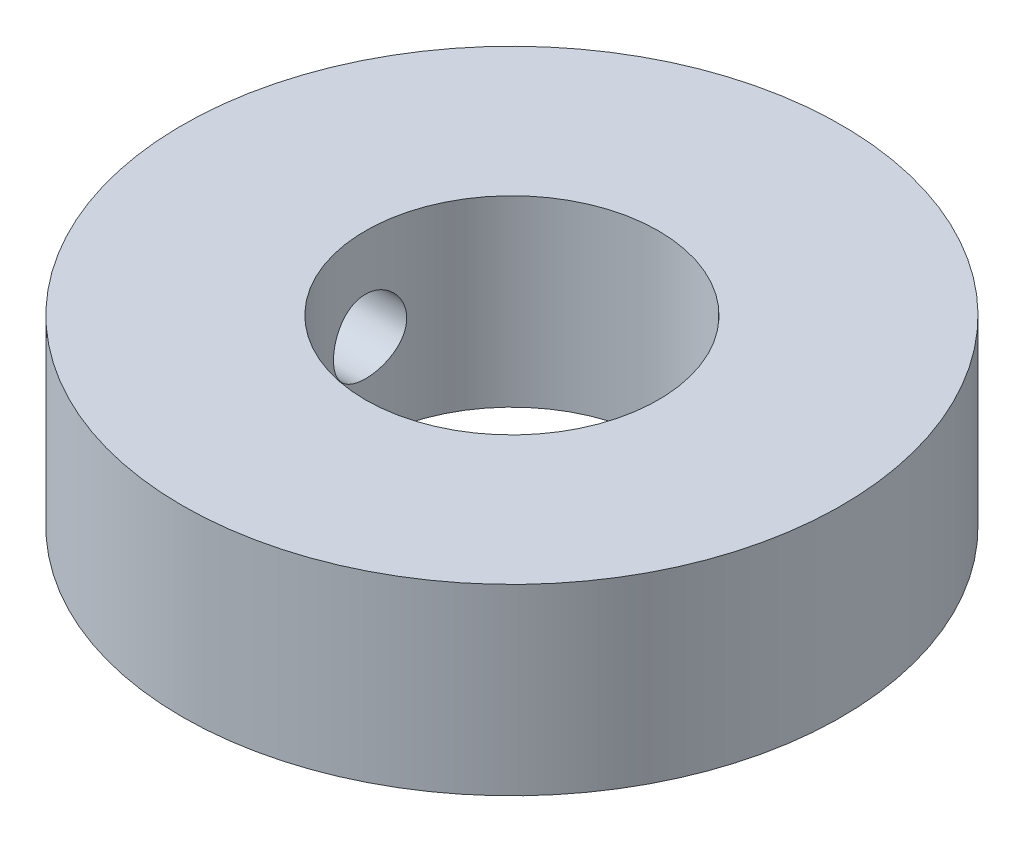
from build123d import *

# Parameters (mm, degrees)
SKETCH_1_R          = 9
SKETCH_1_R_2        = 4
EXTRUDE_1_DEPTH     = 5
SKETCH_2_R          = 1
CUT_EXTRUDE_1_DEPTH = 15


with BuildPart() as part:
    # 草图1 → 凸台-拉伸1 (new body)
    with BuildSketch(Plane(origin=(0, 0, 0), x_dir=(1, 0, 0), z_dir=(0, 1, 0))):
        with Locations(Location((0, 0, 0), (0, 0, 270))):
            Circle(SKETCH_1_R)
        with Locations(Location((0, 0, 0), (0, 0, 270))):
            Circle(SKETCH_1_R_2, mode=Mode.SUBTRACT)
    extrude(amount=EXTRUDE_1_DEPTH)

    # 草图2 → 切除-拉伸1 (cut)
    with BuildSketch(Plane(origin=(0, 0, 0), x_dir=(0, 0, -1), z_dir=(1, 0, 0))):
        with Locations((0, 2.5)):
            Circle(SKETCH_2_R)
    extrude(amount=-CUT_EXTRUDE_1_DEPTH, mode=Mode.SUBTRACT)


solid = part.part
